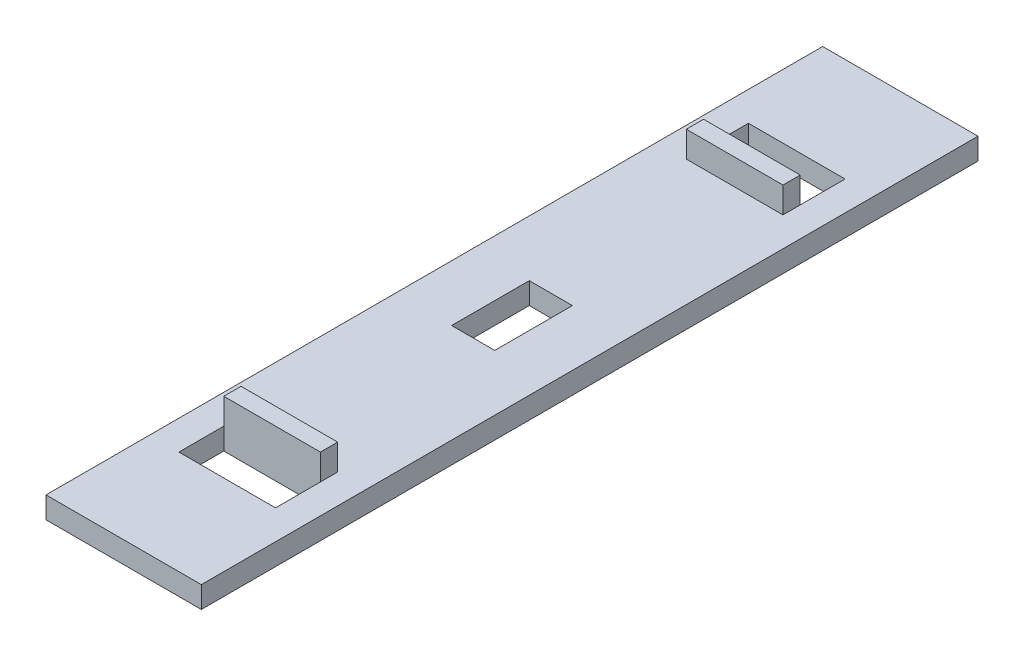
from build123d import *

# Parameters (mm, degrees)
ESQUISSE1_W                  = 9
ESQUISSE1_H                  = 45
ESQUISSE1_W_2                = 5.6
ESQUISSE1_H_2                = 2.6
BOSS_EXTRU_1_DEPTH           = 1.25
ENL_V_MAT_EXTRU_1_DEPTH      = 44.859616193
ENL_V_MAT_EXTRU_1_DEPTH_BACK = 44.859616193
ESQUISSE2_W                  = 2.5
ESQUISSE2_H                  = 4.5
ESQUISSE3_W                  = 5.6
ESQUISSE3_H                  = 1
BOSS_EXTRU_2_DEPTH           = 1.5


with BuildPart() as part:
    # Esquisse1 → Boss.-Extru.1 (new body)
    with BuildSketch(Plane(origin=(0, 0, 0), x_dir=(1, 0, 0), z_dir=(0, 1, 0))):
        with Locations((3.408982136, 20.622516556)):
            Rectangle(ESQUISSE1_W, ESQUISSE1_H)
        with Locations((3.408982136, 35.822516556)):
            Rectangle(ESQUISSE1_W_2, ESQUISSE1_H_2, mode=Mode.SUBTRACT)
        with Locations((3.408982136, 5.422516556)):
            Rectangle(ESQUISSE1_W_2, ESQUISSE1_H_2, mode=Mode.SUBTRACT)
    extrude(amount=BOSS_EXTRU_1_DEPTH)

    # Esquisse2 → Enlèv. mat.-Extru.1 (cut, two sides: drawn at the far end of the back side and taken through both)
    with BuildSketch(Plane.XZ.offset(-ENL_V_MAT_EXTRU_1_DEPTH_BACK)):
        with Locations((3.408982136, -20.622516556)):
            Rectangle(ESQUISSE2_W, ESQUISSE2_H)
    extrude(amount=ENL_V_MAT_EXTRU_1_DEPTH + ENL_V_MAT_EXTRU_1_DEPTH_BACK, mode=Mode.SUBTRACT)

    # Esquisse3 → Boss.-Extru.2 (add)
    with BuildSketch(Plane(origin=(0, 1.25, 0), x_dir=(1, 0, 0), z_dir=(0, 1, 0))):
        with Locations((3.408982136, 7.222516556)):
            Rectangle(ESQUISSE3_W, ESQUISSE3_H)
        with Locations((3.408982136, 34.022516556)):
            Rectangle(ESQUISSE3_W, ESQUISSE3_H)
    extrude(amount=BOSS_EXTRU_2_DEPTH)


solid = part.part
